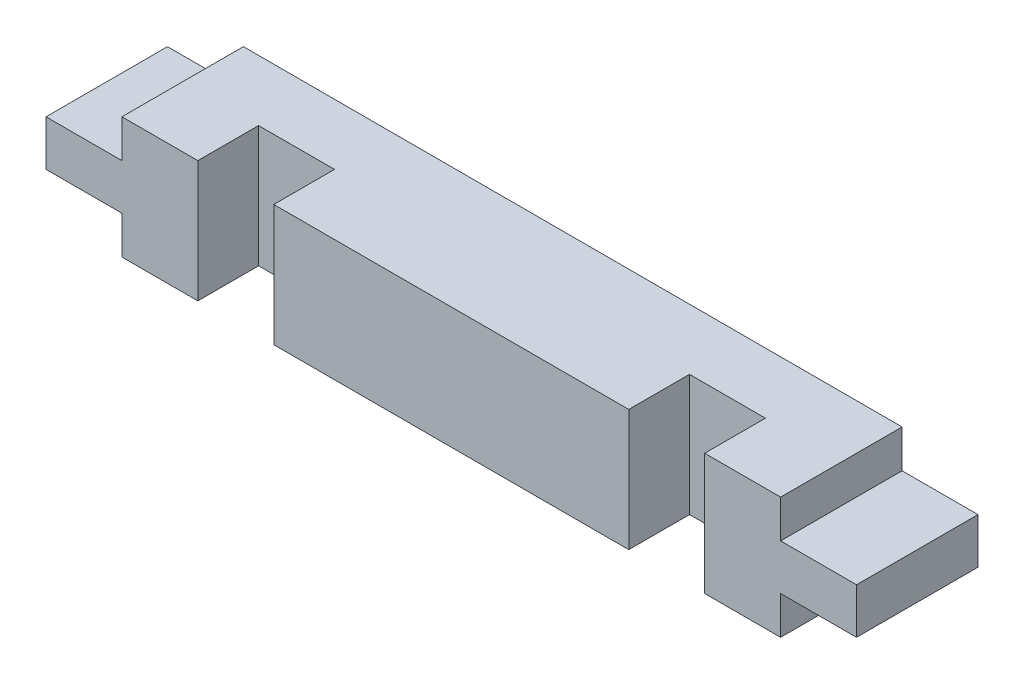
from build123d import *

# Parameters (mm, degrees)
BOSS_EXTRUDE1_DEPTH = 8
SKETCH2_W           = 5
SKETCH2_H           = 8
CUT_EXTRUDE1_DEPTH  = 4


with BuildPart() as part:
    # Sketch1 → Boss-Extrude1 (new body)
    with BuildSketch(Plane.XY):
        Polygon((0, 0), (0, 3), (5, 3), (5, 5.5), (48.38, 5.5), (48.38, 3), (53.38, 3), (53.38, 0), (48.38, 0), (48.38, -2.5), (5, -2.5), (5, 0), align=None)
    extrude(amount=BOSS_EXTRUDE1_DEPTH)

    # Sketch2 → Cut-Extrude1 (cut)
    with BuildSketch(Plane.XY.offset(8)):
        with Locations((12.5, 1.5)):
            Rectangle(SKETCH2_W, SKETCH2_H)
        with Locations((40.88, 1.5)):
            Rectangle(SKETCH2_W, SKETCH2_H)
    extrude(amount=-CUT_EXTRUDE1_DEPTH, mode=Mode.SUBTRACT)


solid = part.part
